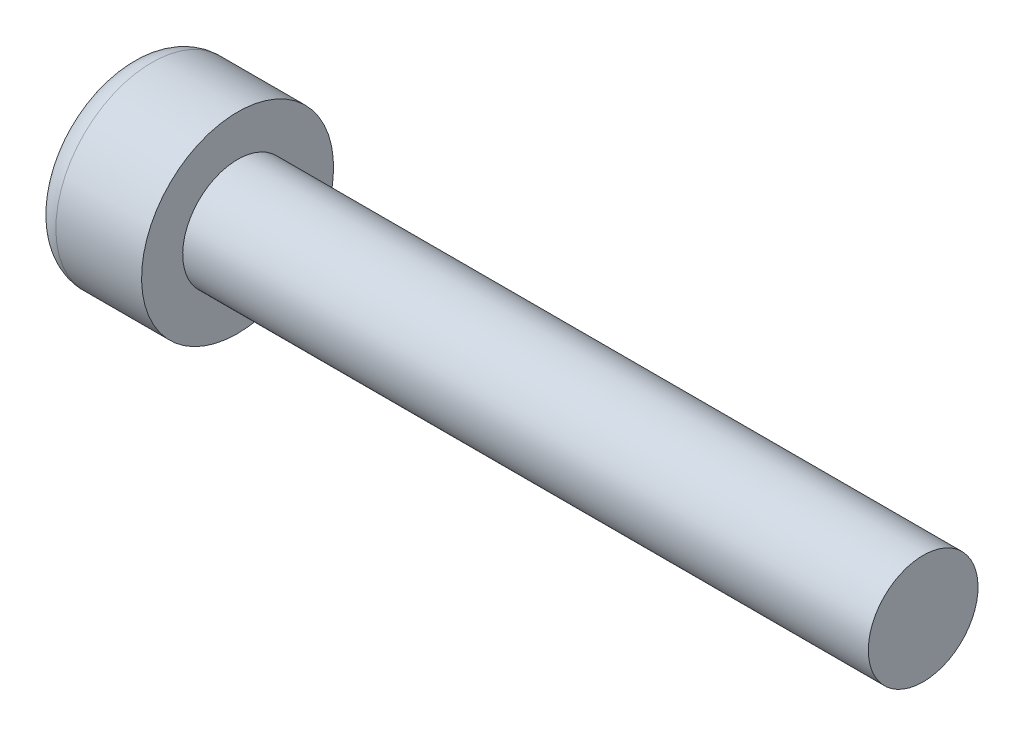
from build123d import *

# Parameters (mm, degrees)
CUT_EXTRUDE1_DEPTH = 2


with BuildPart() as part:
    # Sketch1 → Revolve1 (revolve)
    with BuildSketch(Plane.XY, mode=Mode.PRIVATE) as revolve1_sk:
        with BuildLine():
            Line((0, 0), (0, 2.625))
            ThreePointArc((0, 2.625), (0.256281566, 3.243718434), (0.875, 3.5))
            Line((0.875, 3.5), (4, 3.5))
            Line((4, 3.5), (4, 2))
            Line((4, 2), (29, 2))
            Line((29, 2), (29, 0))
            Line((29, 0), (0, 0))
        make_face()
    revolve(revolve1_sk.sketch.rotate(Axis((0, 0, 0), (1, 0, 0)), 180), axis=Axis((0, 0, 0), (1, 0, 0)))

    # Sketch2 → Cut-Extrude1 (cut)
    with BuildSketch(Plane.ZY):
        Polygon((0, 1.732050808), (-1.5, 0.866025404), (-1.5, -0.866025404), (0, -1.732050808), (1.5, -0.866025404), (1.5, 0.866025404), align=None)
    extrude(amount=-CUT_EXTRUDE1_DEPTH, mode=Mode.SUBTRACT)


solid = part.part
